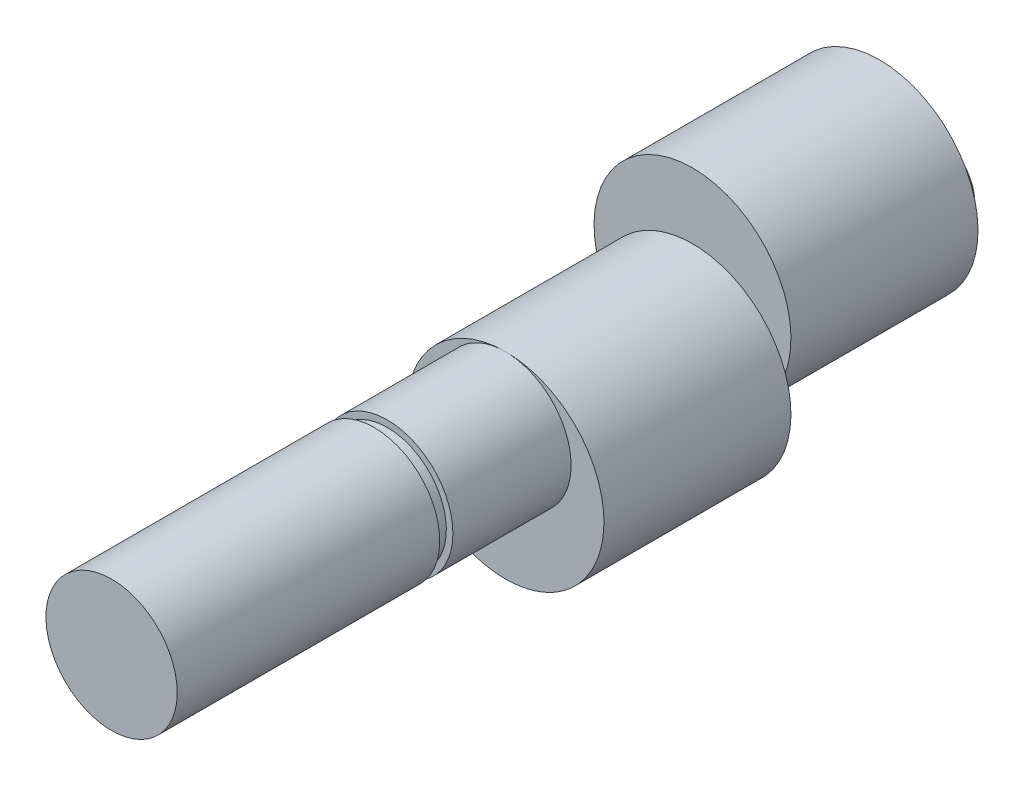
from build123d import *

# Parameters (mm, degrees)
SKETCH1_R           = 7.5
BOSS_EXTRUDE1_DEPTH = 14.25
SKETCH2_R           = 7.5
BOSS_EXTRUDE2_DEPTH = 14.25
SKETCH3_R           = 3
CUT_EXTRUDE1_DEPTH  = 32.120732639
SKETCH4_R           = 3
BOSS_EXTRUDE3_DEPTH = 4.25
SKETCH4_2_R         = 3
BOSS_EXTRUDE4_DEPTH = 28.5
SKETCH5_R           = 5
BOSS_EXTRUDE5_DEPTH = 30
SKETCH7_W           = 1
SKETCH7_H           = 2.291482858


with BuildPart() as part:
    # Sketch1 → Boss-Extrude1 (new body)
    with BuildSketch(Plane.XY):
        with Locations(Location((0, -2.5, 0), (0, 0, 180))):
            Circle(SKETCH1_R)
    extrude(amount=BOSS_EXTRUDE1_DEPTH)

    # Sketch2 → Boss-Extrude2 (add)
    with BuildSketch(Plane(origin=(0, 0, 0), x_dir=(-1, 0, 0), z_dir=(0, 0, -1))):
        with Locations(Location((0, 2.5, 0), (0, 0, 199.471220634))):
            Circle(SKETCH2_R)
    extrude(amount=BOSS_EXTRUDE2_DEPTH)

    # Sketch3 → Cut-Extrude1 (cut, through all)
    with BuildSketch(Plane(origin=(0, 0, -14.25), x_dir=(-1, 0, 0), z_dir=(0, 0, -1))):
        Circle(SKETCH3_R)
    extrude(amount=-CUT_EXTRUDE1_DEPTH, mode=Mode.SUBTRACT)



with BuildPart() as body_2:
    # Sketch4 → Boss-Extrude3 (new body)
    with BuildSketch(Plane(origin=(0, 0, -14.25), x_dir=(-1, 0, 0), z_dir=(0, 0, -1))):
        Circle(SKETCH4_R)
    extrude(amount=BOSS_EXTRUDE3_DEPTH)


with BuildPart() as part_1:
    add(part.part)

    add(body_2.part)  # Boss-Extrude4 merges body 2
    # Sketch4<2> → Boss-Extrude4 (add)
    with BuildSketch(Plane(origin=(0, 0, -14.25), x_dir=(-1, 0, 0), z_dir=(0, 0, -1))):
        Circle(SKETCH4_2_R)
    extrude(amount=-BOSS_EXTRUDE4_DEPTH)

    # Sketch5 → Boss-Extrude5 (add)
    with BuildSketch(Plane.XY.offset(14.25)):
        with Locations(Location((0, 0, 0), (0, 0, 89.999372356))):
            Circle(SKETCH5_R)
    extrude(amount=BOSS_EXTRUDE5_DEPTH)

    # Sketch7 → Cut-Revolve1 (revolve, cut)
    with BuildSketch(Plane(origin=(0, 0, 0), x_dir=(0, 0, -1), z_dir=(1, 0, 0))):
        with Locations((-23.75, 5.645741429)):
            Rectangle(SKETCH7_W, SKETCH7_H)
    revolve(axis=Axis((0, 0, 44.25), (0, 0, -1)), mode=Mode.SUBTRACT)


solid = part_1.part
